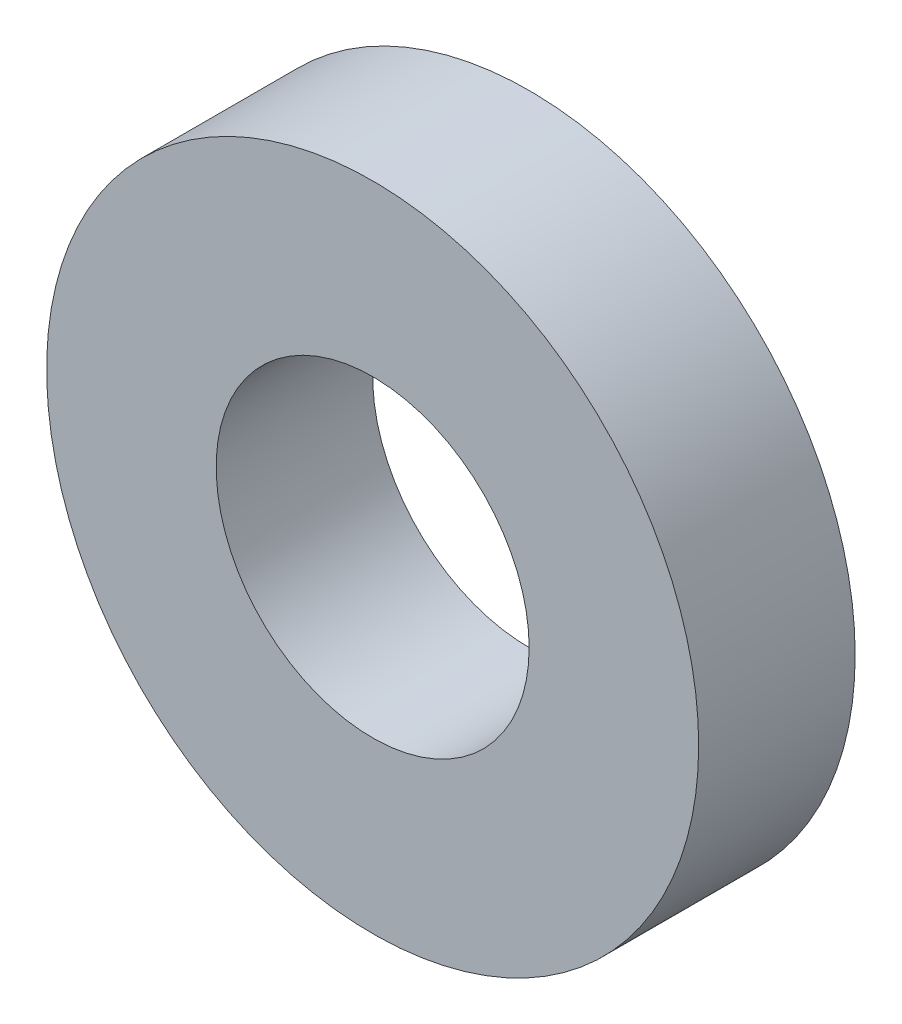
from build123d import *

# Parameters (mm, degrees)
SKETCH_1_R               = 12.5
EXTRUDE_1_DEPTH          = 6
CUT_EXTRUDE_1_DEPTH      = 19.668154703
CUT_EXTRUDE_1_DEPTH_BACK = 19.668154703
SKETCH_2_R               = 6


with BuildPart() as part:
    # 草图1 → 凸台-拉伸1 (new body)
    with BuildSketch(Plane.XY):
        Circle(SKETCH_1_R)
    extrude(amount=EXTRUDE_1_DEPTH)

    # 草图2 → 切除-拉伸1 (cut, two sides: drawn at the far end of the back side and taken through both)
    with BuildSketch(Plane.XY.offset(6).offset(-CUT_EXTRUDE_1_DEPTH_BACK)):
        Circle(SKETCH_2_R)
    extrude(amount=CUT_EXTRUDE_1_DEPTH + CUT_EXTRUDE_1_DEPTH_BACK, mode=Mode.SUBTRACT)


solid = part.part
